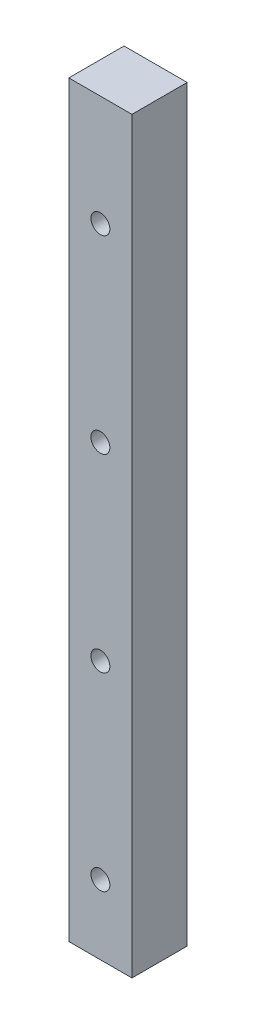
from build123d import *

# Parameters (mm, degrees)
SKETCH_1_W          = 20
SKETCH_1_H          = 17.5
EXTRUDE_1_DEPTH     = 237
SKETCH_2_R          = 3
CUT_EXTRUDE_1_DEPTH = 238.855523375
CUT_EXTRUDE_START   = -17.5
SKETCH_3_R          = 4.75
CUT_EXTRUDE_2_DEPTH = 8.5


with BuildPart() as part:
    # 草图1 → 凸台-拉伸1 (new body)
    with BuildSketch(Plane(origin=(0, 0, 0), x_dir=(1, 0, 0), z_dir=(0, 1, 0))):
        with Locations((0, 8.75)):
            Rectangle(SKETCH_1_W, SKETCH_1_H)
    extrude(amount=EXTRUDE_1_DEPTH)

    # 草图2 → 切除-拉伸1 (cut, through all)
    with BuildSketch(Plane.XY):
        with Locations((0, 22)):
            Circle(SKETCH_2_R)
        with Locations((0, 82)):
            Circle(SKETCH_2_R)
        with Locations((0, 142)):
            Circle(SKETCH_2_R)
        with Locations((0, 202)):
            Circle(SKETCH_2_R)
        with Locations((0, 262)):
            Circle(SKETCH_2_R)
    extrude(amount=-CUT_EXTRUDE_1_DEPTH, mode=Mode.SUBTRACT)

    # 草图3 → 切除-拉伸2 (cut)
    with BuildSketch(Plane.XY.offset(CUT_EXTRUDE_START)):
        with Locations((0, 22)):
            Circle(SKETCH_3_R)
        with Locations((0, 82)):
            Circle(SKETCH_3_R)
        with Locations((0, 142)):
            Circle(SKETCH_3_R)
        with Locations((0, 202)):
            Circle(SKETCH_3_R)
        with Locations((0, 262)):
            Circle(SKETCH_3_R)
    extrude(amount=CUT_EXTRUDE_2_DEPTH, mode=Mode.SUBTRACT)


solid = part.part
